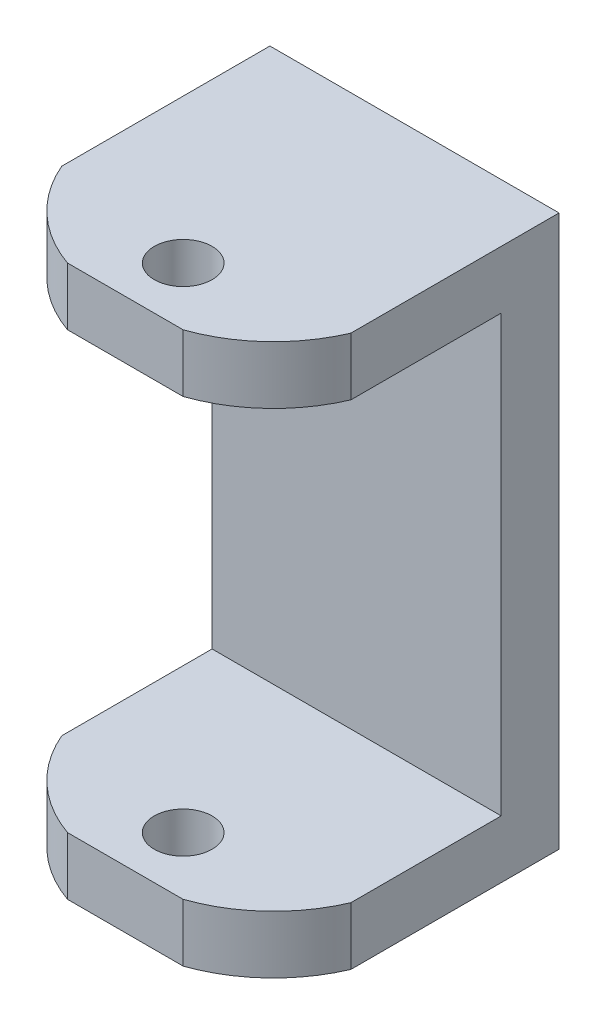
from build123d import *

# Parameters (mm, degrees)
SKETCH1_R           = 2.5
BOSS_EXTRUDE1_DEPTH = 47.65
SKETCH2_W           = 20
SKETCH2_H           = 37.65
CUT_EXTRUDE1_DEPTH  = 60.333991101


with BuildPart() as part:
    # Sketch1 → Boss-Extrude1 (new body)
    with BuildSketch(Plane(origin=(0, 0, 0), x_dir=(1, 0, 0), z_dir=(0, 1, 0))):
        with BuildLine():
            Line((-5, 0), (5, 0))
            ThreePointArc((5, 0), (9.487755282, 2.709547912), (12.5, 7))
            Line((12.5, 7), (12.5, 25))
            Line((12.5, 25), (-12.5, 25))
            Line((-12.5, 25), (-12.5, 7))
            ThreePointArc((-12.5, 7), (-9.487755282, 2.709547912), (-5, 0))
        make_face()
        with Locations(Location((0, 5, 0), (0, 0, 270))):
            Circle(SKETCH1_R, mode=Mode.SUBTRACT)
    extrude(amount=BOSS_EXTRUDE1_DEPTH)

    # Sketch2 → Cut-Extrude1 (cut, through all)
    with BuildSketch(Plane.ZY.offset(12.5)):
        with Locations((-10, 23.825)):
            Rectangle(SKETCH2_W, SKETCH2_H)
    extrude(amount=-CUT_EXTRUDE1_DEPTH, mode=Mode.SUBTRACT)


solid = part.part
